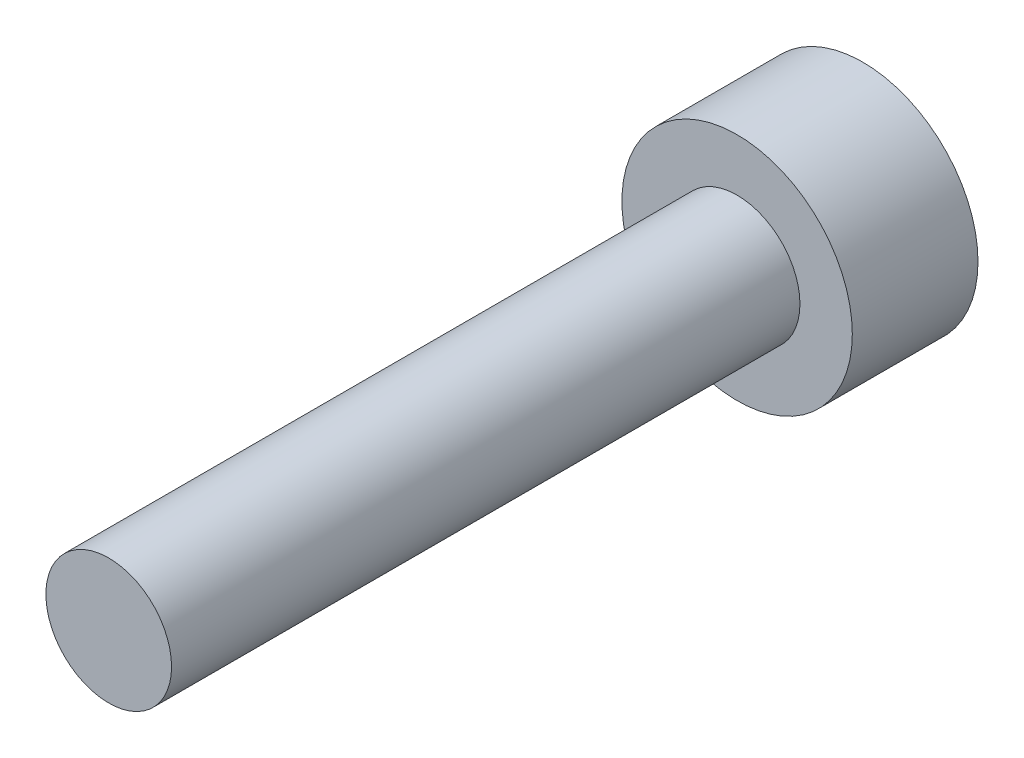
from build123d import *

# Parameters (mm, degrees)
ESBO_O1_R                = 2.75
RESSALTO_EXTRUS_O1_DEPTH = 3
ESBO_O2_R                = 1.5
RESSALTO_EXTRUS_O2_DEPTH = 15


with BuildPart() as part:
    # Esboço1 → Ressalto-extrusão1 (new body)
    with BuildSketch(Plane.XY):
        Circle(ESBO_O1_R)
    extrude(amount=RESSALTO_EXTRUS_O1_DEPTH)

    # Esboço2 → Ressalto-extrusão2 (add)
    with BuildSketch(Plane.XY.offset(3)):
        Circle(ESBO_O2_R)
    extrude(amount=RESSALTO_EXTRUS_O2_DEPTH)


solid = part.part
